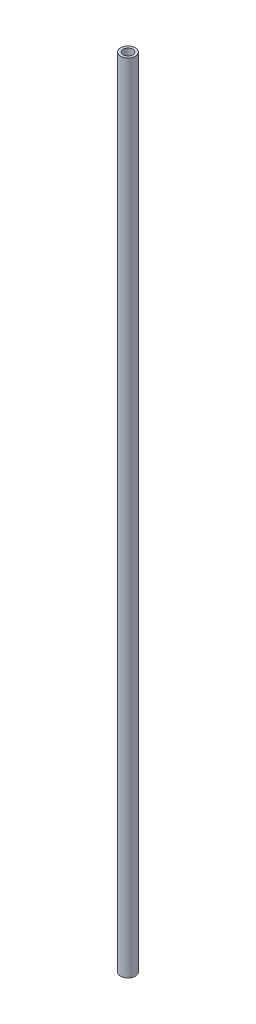
from build123d import *

# Parameters (mm, degrees)
SKETCH1_R           = 2.9
SKETCH1_R_2         = 1.9
BOSS_EXTRUDE1_DEPTH = 313


with BuildPart() as part:
    # Sketch1 → Boss-Extrude1 (new body)
    with BuildSketch(Plane(origin=(0, 0, 0), x_dir=(1, 0, 0), z_dir=(0, 1, 0))):
        with Locations(Location((0, 0, 0), (0, 0, 270))):
            Circle(SKETCH1_R)
        with Locations(Location((0, 0, 0), (0, 0, 270))):
            Circle(SKETCH1_R_2, mode=Mode.SUBTRACT)
    extrude(amount=BOSS_EXTRUDE1_DEPTH)


solid = part.part
